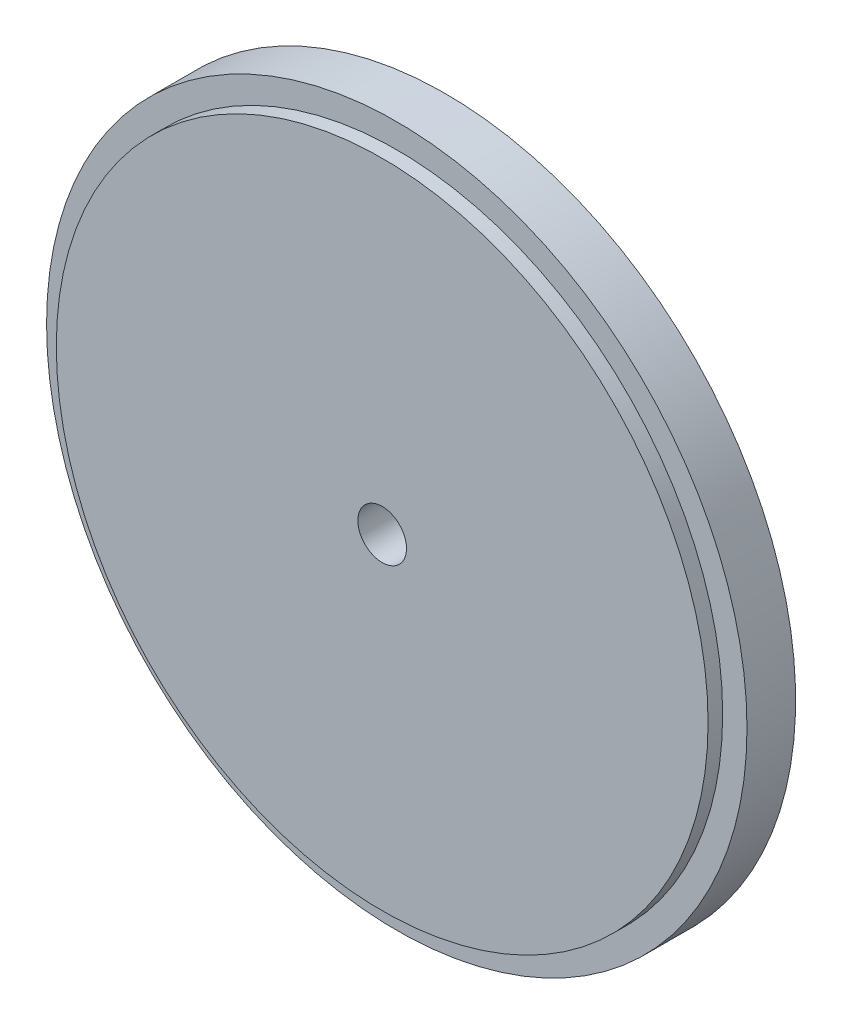
from build123d import *

# Parameters (mm, degrees)
ESBO_O1_R                     = 35
ESBO_O1_R_2                   = 32.5
RESSALTO_EXTRUS_O1_DEPTH      = 8
RESSALTO_EXTRUS_O2_START      = -3
ESBO_O2_R                     = 32.5
RESSALTO_EXTRUS_O2_DEPTH      = 3
ESBO_O3_R                     = 2.5
CORTE_EXTRUS_O1_DEPTH         = 3
RESSALTO_EXTRUS_O3_DEPTH      = 5
RESSALTO_EXTRUS_O3_DEPTH_BACK = 3
ESBO_O4_R                     = 37
ESBO_O4_R_2                   = 35
ESBO_O5_W                     = 1.8
ESBO_O5_H                     = 3
ESBO_O6_R                     = 12.55
RESSALTO_EXTRUS_O4_DEPTH      = 5
CORTE_EXTRUS_O2_DEPTH         = 53.933921071
CORTE_EXTRUS_O2_DEPTH_BACK    = 53.933921071
ESBO_O7_R                     = 7.55
RESSALTO_EXTRUS_O5_START      = -8
ESBO_O8_R                     = 37
ESBO_O8_R_2                   = 32.5
RESSALTO_EXTRUS_O5_DEPTH      = 8
ESBO_O9_R                     = 37
ESBO_O9_R_2                   = 33.5
CORTE_EXTRUS_O8_DEPTH         = 1.5
CORTE_EXTRUS_O9_START         = -1.5
ESBO_O12_R                    = 37
ESBO_O12_R_2                  = 33.5
CORTE_EXTRUS_O9_DEPTH         = 1.5
CORTE_EXTRUS_O10_START        = -10
ESBO_O13_R                    = 37
ESBO_O13_R_2                  = 36
CORTE_EXTRUS_O10_DEPTH        = 10
ESBO_O14_R                    = 37
ESBO_O14_R_2                  = 36
RESSALTO_EXTRUS_O6_DEPTH      = 5
ESBO_O15_R                    = 12.55
CORTE_EXTRUS_O11_DEPTH        = 53.933921071
ESBO_O16_R                    = 12.55
RESSALTO_EXTRUS_O7_DEPTH      = 3
ESBO_O17_R                    = 10
RESSALTO_EXTRUS_O8_DEPTH      = 16
ESBO_O18_R                    = 2.5
CORTE_EXTRUS_O12_DEPTH        = 56.668662639
ESBO_O19_W                    = 5.95
ESBO_O19_H                    = 2.65
CORTE_EXTRUS_O13_DEPTH        = 8
CORTE_EXTRUS_O14_DEPTH        = 57.676714795
CORTE_EXTRUS_O14_DEPTH_BACK   = 57.676714795
ESBO_O21_R                    = 1.65
ESBO_O23_R                    = 37
ESBO_O23_R_2                  = 36
CORTE_EXTRUS_O15_DEPTH        = 54.798234195


with BuildPart() as part:
    # Esboço1 → Ressalto-extrusão1 (new body)
    with BuildSketch(Plane.XY):
        Circle(ESBO_O1_R)
        Circle(ESBO_O1_R_2, mode=Mode.SUBTRACT)
    extrude(amount=RESSALTO_EXTRUS_O1_DEPTH)

    # Esboço2 → Ressalto-extrusão2 (add)
    with BuildSketch(Plane.XY.offset(8).offset(RESSALTO_EXTRUS_O2_START)):
        Circle(ESBO_O2_R)
    extrude(amount=RESSALTO_EXTRUS_O2_DEPTH)

    # Esboço3 → Corte-extrusão1 (cut)
    with BuildSketch(Plane.XY.offset(8)):
        Circle(ESBO_O3_R)
    extrude(amount=-CORTE_EXTRUS_O1_DEPTH, mode=Mode.SUBTRACT)

    # Esboço4 → Ressalto-extrusão3 (add, two sides: drawn at the far end of the back side and taken through both)
    with BuildSketch(Plane(origin=(0, 0, 5), x_dir=(-1, 0, 0), z_dir=(0, 0, -1)).offset(-RESSALTO_EXTRUS_O3_DEPTH_BACK)):
        Circle(ESBO_O4_R)
        Circle(ESBO_O4_R_2, mode=Mode.SUBTRACT)
    extrude(amount=RESSALTO_EXTRUS_O3_DEPTH + RESSALTO_EXTRUS_O3_DEPTH_BACK)

    # Esboço5 → Corte-Revolução1 (revolve, cut)
    with BuildSketch(Plane(origin=(0, 0, 0), x_dir=(1, 0, 0), z_dir=(0, 1, 0))):
        with Locations((-36.1, -2.5)):
            Rectangle(ESBO_O5_W, ESBO_O5_H)
        with Locations((-36.1, -5.5)):
            Rectangle(ESBO_O5_W, ESBO_O5_H)
    revolve(axis=Axis((0, 0, 8), (0, 0, -1)), mode=Mode.SUBTRACT)

    # Esboço6 → Ressalto-extrusão4 (add)
    with BuildSketch(Plane(origin=(0, 0, 5), x_dir=(-1, 0, 0), z_dir=(0, 0, -1))):
        with Locations(Location((0, 0, 0), (0, 0, 180))):
            Circle(ESBO_O6_R)
    extrude(amount=RESSALTO_EXTRUS_O4_DEPTH)

    # Esboço7 → Corte-extrusão2 (cut, two sides: drawn at the far end of the back side and taken through both)
    with BuildSketch(Plane(origin=(0, 0, 0), x_dir=(-1, 0, 0), z_dir=(0, 0, -1)).offset(-CORTE_EXTRUS_O2_DEPTH_BACK)):
        Circle(ESBO_O7_R)
    extrude(amount=CORTE_EXTRUS_O2_DEPTH + CORTE_EXTRUS_O2_DEPTH_BACK, mode=Mode.SUBTRACT)

    # Esboço8 → Ressalto-extrusão5 (add)
    with BuildSketch(Plane.XY.offset(8).offset(RESSALTO_EXTRUS_O5_START)):
        with Locations(Location((0, 0, 0), (0, 0, 180))):
            Circle(ESBO_O8_R)
        Circle(ESBO_O8_R_2, mode=Mode.SUBTRACT)
    extrude(amount=RESSALTO_EXTRUS_O5_DEPTH)

    # Esboço9 → Corte-extrusão8 (cut)
    with BuildSketch(Plane.XY.offset(8)):
        with Locations(Location((0, 0, 0), (0, 0, 180))):
            Circle(ESBO_O9_R)
        Circle(ESBO_O9_R_2, mode=Mode.SUBTRACT)
    extrude(amount=-CORTE_EXTRUS_O8_DEPTH, mode=Mode.SUBTRACT)

    # Esboço12 → Corte-extrusão9 (cut)
    with BuildSketch(Plane(origin=(0, 0, 0), x_dir=(-1, 0, 0), z_dir=(0, 0, -1)).offset(CORTE_EXTRUS_O9_START)):
        Circle(ESBO_O12_R)
        with Locations(Location((0, 0, 0), (0, 0, 180))):
            Circle(ESBO_O12_R_2, mode=Mode.SUBTRACT)
    extrude(amount=CORTE_EXTRUS_O9_DEPTH, mode=Mode.SUBTRACT)

    # Esboço13 → Corte-extrusão10 (cut)
    with BuildSketch(Plane(origin=(0, 0, 1.5), x_dir=(-1, 0, 0), z_dir=(0, 0, -1)).offset(CORTE_EXTRUS_O10_START)):
        Circle(ESBO_O13_R)
        Circle(ESBO_O13_R_2, mode=Mode.SUBTRACT)
    extrude(amount=CORTE_EXTRUS_O10_DEPTH, mode=Mode.SUBTRACT)

    # Esboço14 → Ressalto-extrusão6 (add)
    with BuildSketch(Plane.XY.offset(6.5)):
        Circle(ESBO_O14_R)
        Circle(ESBO_O14_R_2, mode=Mode.SUBTRACT)
    extrude(amount=-RESSALTO_EXTRUS_O6_DEPTH)

    # Esboço15 → Corte-extrusão11 (cut, through all)
    with BuildSketch(Plane(origin=(0, 0, 0), x_dir=(-1, 0, 0), z_dir=(0, 0, -1))):
        Circle(ESBO_O15_R)
    extrude(amount=-CORTE_EXTRUS_O11_DEPTH, mode=Mode.SUBTRACT)

    # Esboço16 → Ressalto-extrusão7 (add, through all)
    with BuildSketch(Plane(origin=(0, 0, 5), x_dir=(-1, 0, 0), z_dir=(0, 0, -1))):
        Circle(ESBO_O16_R)
    extrude(amount=-RESSALTO_EXTRUS_O7_DEPTH)

    # Esboço17 → Ressalto-extrusão8 (add)
    with BuildSketch(Plane(origin=(0, 0, 5), x_dir=(-1, 0, 0), z_dir=(0, 0, -1))):
        with Locations(Location((0, 0, 0), (0, 0, 180))):
            Circle(ESBO_O17_R)
    extrude(amount=RESSALTO_EXTRUS_O8_DEPTH)

    # Esboço18 → Corte-extrusão12 (cut, through all)
    with BuildSketch(Plane(origin=(0, 0, -11), x_dir=(-1, 0, 0), z_dir=(0, 0, -1))):
        Circle(ESBO_O18_R)
    extrude(amount=-CORTE_EXTRUS_O12_DEPTH, mode=Mode.SUBTRACT)

    # Esboço19 → Corte-extrusão13 (cut)
    with BuildSketch(Plane(origin=(0, 0, -11), x_dir=(-1, 0, 0), z_dir=(0, 0, -1))):
        with Locations((0, -5.825)):
            Rectangle(ESBO_O19_W, ESBO_O19_H)
        with Locations((0, 5.825)):
            Rectangle(ESBO_O19_W, ESBO_O19_H)
    extrude(amount=-CORTE_EXTRUS_O13_DEPTH, mode=Mode.SUBTRACT)

    # Esboço21 → Corte-extrusão14 (cut, two sides: drawn at the far end of the back side and taken through both)
    with BuildSketch(Plane(origin=(0, 4.5, 0), x_dir=(1, 0, 0), z_dir=(0, 1, 0)).offset(-CORTE_EXTRUS_O14_DEPTH_BACK)):
        with Locations(Location((0, 6.85, 0), (0, 0, 180))):
            Circle(ESBO_O21_R)
    extrude(amount=CORTE_EXTRUS_O14_DEPTH + CORTE_EXTRUS_O14_DEPTH_BACK, mode=Mode.SUBTRACT)

    # Esboço23 → Corte-extrusão15 (cut, through all)
    with BuildSketch(Plane(origin=(0, 0, 1.5), x_dir=(-1, 0, 0), z_dir=(0, 0, -1))):
        Circle(ESBO_O23_R)
        Circle(ESBO_O23_R_2, mode=Mode.SUBTRACT)
    extrude(amount=-CORTE_EXTRUS_O15_DEPTH, mode=Mode.SUBTRACT)


solid = part.part
